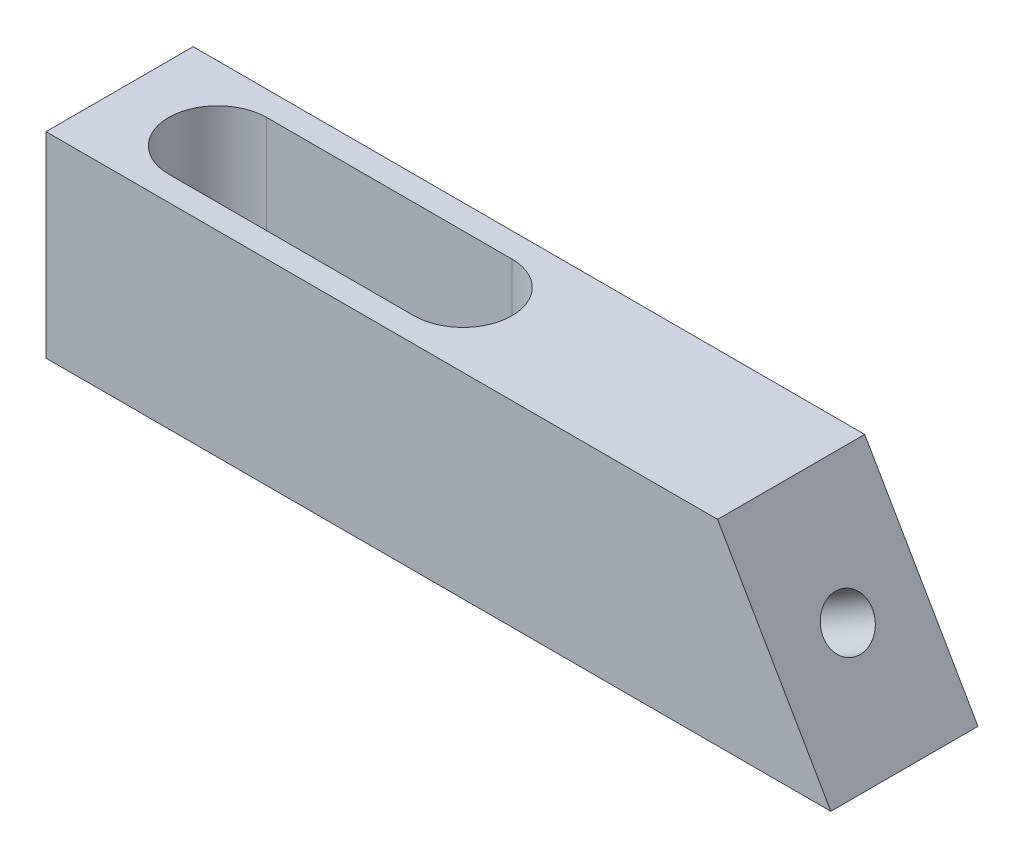
from build123d import *

# Parameters (mm, degrees)
BOSS_EXTRUDE1_DEPTH = 19.05
SKETCH2_W           = 12.7
SKETCH2_H           = 49.430607356
CUT_EXTRUDE1_DEPTH  = 81.742636051
SKETCH3_R           = 3.1877
CUT_EXTRUDE2_DEPTH  = 91.02678768
CUT_EXTRUDE3_DEPTH  = 12.7
SKETCH4_3_R         = 3.1877
CUT_EXTRUDE5_DEPTH  = 107.4453968


with BuildPart() as part:
    # Sketch1 → Boss-Extrude1 (new body)
    with BuildSketch(Plane.XY):
        Polygon((0, 0), (0, 25.4), (86.935303163, 25.4), (101.6, 0), align=None)
    extrude(amount=BOSS_EXTRUDE1_DEPTH)

    # Sketch2 → Cut-Extrude1 (cut, through all)
    with BuildSketch(Plane(origin=(67.951108029, 39.231590512, 0), x_dir=(0, 0, -1), z_dir=(0.8660254037844359, 0.5000000000000048, 0))):
        with Locations((-9.525, -49.360910003)):
            Rectangle(SKETCH2_W, SKETCH2_H)
    extrude(amount=-CUT_EXTRUDE1_DEPTH, mode=Mode.SUBTRACT)

    # Sketch3 → Cut-Extrude2 (cut, through all)
    with BuildSketch(Plane(origin=(76.2, 43.994090512, 0), x_dir=(0, 0, -1), z_dir=(0.8660254037844359, 0.5000000000000048, 0))):
        with Locations((-9.525, -36.135303163)):
            Circle(SKETCH3_R)
    extrude(amount=-CUT_EXTRUDE2_DEPTH, mode=Mode.SUBTRACT)

    # Sketch4 → Cut-Extrude3 (cut)
    with BuildSketch(Plane(origin=(0, 25.4, 0), x_dir=(1, 0, 0), z_dir=(0, 1, 0))):
        with BuildLine():
            Line((12.7, -3.175), (44.45, -3.175))
            ThreePointArc((44.45, -3.175), (50.8, -9.525), (44.45, -15.875))
            Line((44.45, -15.875), (12.7, -15.875))
            ThreePointArc((12.7, -15.875), (6.35, -9.525), (12.7, -3.175))
        make_face()
    extrude(amount=-CUT_EXTRUDE3_DEPTH, mode=Mode.SUBTRACT)

    # Sketch4<3> → Cut-Extrude5 (cut, through all)
    with BuildSketch(Plane(origin=(0, 25.4, 0), x_dir=(1, 0, 0), z_dir=(0, 1, 0))):
        with Locations((12.7, -9.525)):
            Circle(SKETCH4_3_R)
        with Locations((44.45, -9.525)):
            Circle(SKETCH4_3_R)
    extrude(amount=-CUT_EXTRUDE5_DEPTH, mode=Mode.SUBTRACT)


solid = part.part
